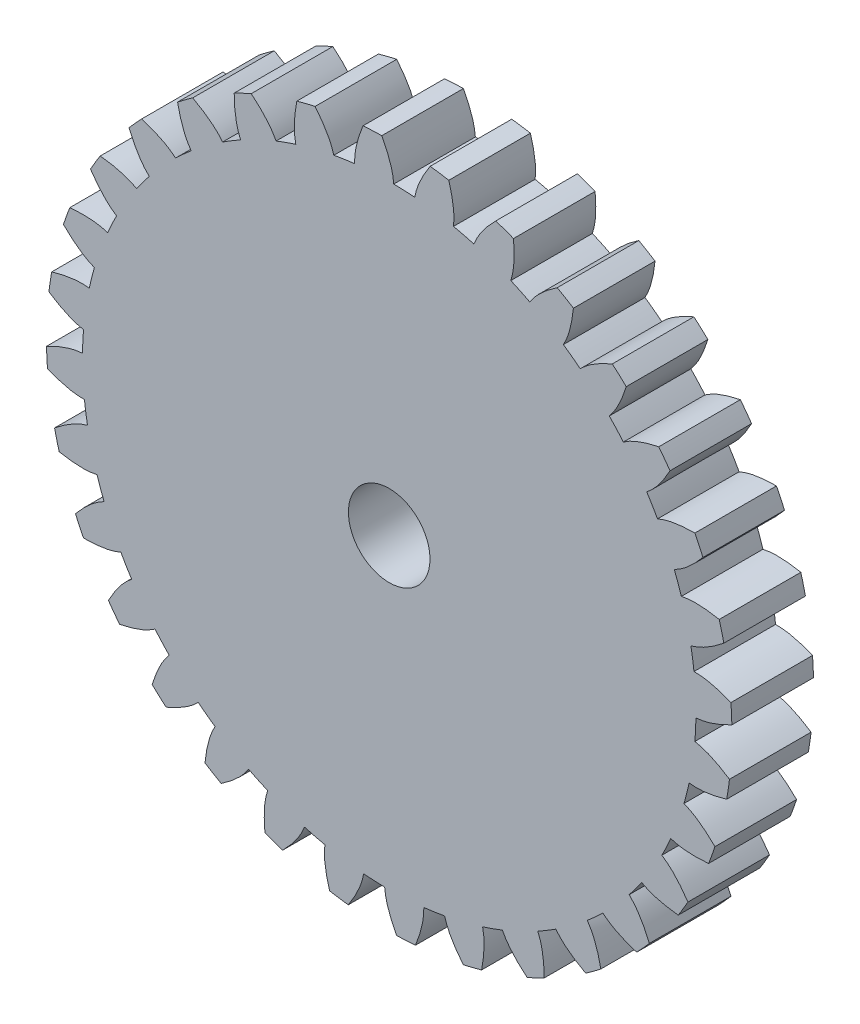
from build123d import *

# Parameters (mm, degrees)
BOSS_EXTRUDE7_DEPTH = 1
CIRPATTERN1_COUNT   = 32
DIAMETRO_BASE_R     = 3.758770483
BOSS_EXTRUDE9_DEPTH = 1
MOZZO_R             = 0.5
CUT_EXTRUDE1_DEPTH  = 1
SKETCH1_R           = 4.25
SKETCH1_R_2         = 4.2
CUT_EXTRUDE2_DEPTH  = 7.090787907


with BuildPart() as part:
    # profilo → Boss-Extrude7 (new body)
    with BuildSketch(Plane.XY):
        with BuildLine():
            Line((-0.208537616, 4.244880689), (-0.184434126, 3.754242879))
            ThreePointArc((-0.184434126, 3.754242879), (-0.064239901, 3.758221492), (0.056020084, 3.758353003))
            add(Edge.make_bspline(
                [(-0.116842984, 4.248393545), (-0.034075941, 4.096076065), (0.042378759, 3.933500457), (0.056020084, 3.758353003)],
                knots=[0.080011926, 0.080011926, 0.080011926, 0.080011926, 1, 1, 1, 1], degree=3))
            ThreePointArc((-0.116842984, 4.248393545), (-0.162699781, 4.246884597), (-0.208537616, 4.244880689))
        make_face()
    extrude(amount=BOSS_EXTRUDE7_DEPTH)

    # Mirror1: part across plane


with BuildPart() as part_1:
    add(part.part)
    add(part.part.mirror(Plane(origin=(0, 0, 0), x_dir=(0, 0, 1), z_dir=(0.9987954562051725, 0.0490676743274181, 0))))


with BuildPart() as cirpattern1_1:
    # CirPattern1: pattern copy
    add(part_1.part.rotate(Axis((0, 0, 0), (0, 0, -1)), 1 * 360 / CIRPATTERN1_COUNT))


with BuildPart() as cirpattern1_2:
    # CirPattern1: pattern copy
    add(part_1.part.rotate(Axis((0, 0, 0), (0, 0, -1)), 2 * 360 / CIRPATTERN1_COUNT))


with BuildPart() as cirpattern1_3:
    # CirPattern1: pattern copy
    add(part_1.part.rotate(Axis((0, 0, 0), (0, 0, -1)), 3 * 360 / CIRPATTERN1_COUNT))


with BuildPart() as cirpattern1_4:
    # CirPattern1: pattern copy
    add(part_1.part.rotate(Axis((0, 0, 0), (0, 0, -1)), 4 * 360 / CIRPATTERN1_COUNT))


with BuildPart() as cirpattern1_5:
    # CirPattern1: pattern copy
    add(part_1.part.rotate(Axis((0, 0, 0), (0, 0, -1)), 5 * 360 / CIRPATTERN1_COUNT))


with BuildPart() as cirpattern1_6:
    # CirPattern1: pattern copy
    add(part_1.part.rotate(Axis((0, 0, 0), (0, 0, -1)), 6 * 360 / CIRPATTERN1_COUNT))


with BuildPart() as cirpattern1_7:
    # CirPattern1: pattern copy
    add(part_1.part.rotate(Axis((0, 0, 0), (0, 0, -1)), 7 * 360 / CIRPATTERN1_COUNT))


with BuildPart() as cirpattern1_8:
    # CirPattern1: pattern copy
    add(part_1.part.rotate(Axis((0, 0, 0), (0, 0, -1)), 8 * 360 / CIRPATTERN1_COUNT))


with BuildPart() as cirpattern1_9:
    # CirPattern1: pattern copy
    add(part_1.part.rotate(Axis((0, 0, 0), (0, 0, -1)), 9 * 360 / CIRPATTERN1_COUNT))


with BuildPart() as cirpattern1_10:
    # CirPattern1: pattern copy
    add(part_1.part.rotate(Axis((0, 0, 0), (0, 0, -1)), 10 * 360 / CIRPATTERN1_COUNT))


with BuildPart() as cirpattern1_11:
    # CirPattern1: pattern copy
    add(part_1.part.rotate(Axis((0, 0, 0), (0, 0, -1)), 11 * 360 / CIRPATTERN1_COUNT))


with BuildPart() as cirpattern1_12:
    # CirPattern1: pattern copy
    add(part_1.part.rotate(Axis((0, 0, 0), (0, 0, -1)), 12 * 360 / CIRPATTERN1_COUNT))


with BuildPart() as cirpattern1_13:
    # CirPattern1: pattern copy
    add(part_1.part.rotate(Axis((0, 0, 0), (0, 0, -1)), 13 * 360 / CIRPATTERN1_COUNT))


with BuildPart() as cirpattern1_14:
    # CirPattern1: pattern copy
    add(part_1.part.rotate(Axis((0, 0, 0), (0, 0, -1)), 14 * 360 / CIRPATTERN1_COUNT))


with BuildPart() as cirpattern1_15:
    # CirPattern1: pattern copy
    add(part_1.part.rotate(Axis((0, 0, 0), (0, 0, -1)), 15 * 360 / CIRPATTERN1_COUNT))


with BuildPart() as cirpattern1_16:
    # CirPattern1: pattern copy
    add(part_1.part.rotate(Axis((0, 0, 0), (0, 0, -1)), 16 * 360 / CIRPATTERN1_COUNT))


with BuildPart() as cirpattern1_17:
    # CirPattern1: pattern copy
    add(part_1.part.rotate(Axis((0, 0, 0), (0, 0, -1)), 17 * 360 / CIRPATTERN1_COUNT))


with BuildPart() as cirpattern1_18:
    # CirPattern1: pattern copy
    add(part_1.part.rotate(Axis((0, 0, 0), (0, 0, -1)), 18 * 360 / CIRPATTERN1_COUNT))


with BuildPart() as cirpattern1_19:
    # CirPattern1: pattern copy
    add(part_1.part.rotate(Axis((0, 0, 0), (0, 0, -1)), 19 * 360 / CIRPATTERN1_COUNT))


with BuildPart() as cirpattern1_20:
    # CirPattern1: pattern copy
    add(part_1.part.rotate(Axis((0, 0, 0), (0, 0, -1)), 20 * 360 / CIRPATTERN1_COUNT))


with BuildPart() as cirpattern1_21:
    # CirPattern1: pattern copy
    add(part_1.part.rotate(Axis((0, 0, 0), (0, 0, -1)), 21 * 360 / CIRPATTERN1_COUNT))


with BuildPart() as cirpattern1_22:
    # CirPattern1: pattern copy
    add(part_1.part.rotate(Axis((0, 0, 0), (0, 0, -1)), 22 * 360 / CIRPATTERN1_COUNT))


with BuildPart() as cirpattern1_23:
    # CirPattern1: pattern copy
    add(part_1.part.rotate(Axis((0, 0, 0), (0, 0, -1)), 23 * 360 / CIRPATTERN1_COUNT))


with BuildPart() as cirpattern1_24:
    # CirPattern1: pattern copy
    add(part_1.part.rotate(Axis((0, 0, 0), (0, 0, -1)), 24 * 360 / CIRPATTERN1_COUNT))


with BuildPart() as cirpattern1_25:
    # CirPattern1: pattern copy
    add(part_1.part.rotate(Axis((0, 0, 0), (0, 0, -1)), 25 * 360 / CIRPATTERN1_COUNT))


with BuildPart() as cirpattern1_26:
    # CirPattern1: pattern copy
    add(part_1.part.rotate(Axis((0, 0, 0), (0, 0, -1)), 26 * 360 / CIRPATTERN1_COUNT))


with BuildPart() as cirpattern1_27:
    # CirPattern1: pattern copy
    add(part_1.part.rotate(Axis((0, 0, 0), (0, 0, -1)), 27 * 360 / CIRPATTERN1_COUNT))


with BuildPart() as cirpattern1_28:
    # CirPattern1: pattern copy
    add(part_1.part.rotate(Axis((0, 0, 0), (0, 0, -1)), 28 * 360 / CIRPATTERN1_COUNT))


with BuildPart() as cirpattern1_29:
    # CirPattern1: pattern copy
    add(part_1.part.rotate(Axis((0, 0, 0), (0, 0, -1)), 29 * 360 / CIRPATTERN1_COUNT))


with BuildPart() as cirpattern1_30:
    # CirPattern1: pattern copy
    add(part_1.part.rotate(Axis((0, 0, 0), (0, 0, -1)), 30 * 360 / CIRPATTERN1_COUNT))


with BuildPart() as cirpattern1_31:
    # CirPattern1: pattern copy
    add(part_1.part.rotate(Axis((0, 0, 0), (0, 0, -1)), 31 * 360 / CIRPATTERN1_COUNT))


with BuildPart() as part_2:
    add(part_1.part)

    add(cirpattern1_1.part)  # Boss-Extrude9 merges CirPattern1_1

    add(cirpattern1_2.part)  # Boss-Extrude9 merges CirPattern1_2

    add(cirpattern1_3.part)  # Boss-Extrude9 merges CirPattern1_3

    add(cirpattern1_4.part)  # Boss-Extrude9 merges CirPattern1_4

    add(cirpattern1_5.part)  # Boss-Extrude9 merges CirPattern1_5

    add(cirpattern1_6.part)  # Boss-Extrude9 merges CirPattern1_6

    add(cirpattern1_7.part)  # Boss-Extrude9 merges CirPattern1_7

    add(cirpattern1_8.part)  # Boss-Extrude9 merges CirPattern1_8

    add(cirpattern1_9.part)  # Boss-Extrude9 merges CirPattern1_9

    add(cirpattern1_10.part)  # Boss-Extrude9 merges CirPattern1_10

    add(cirpattern1_11.part)  # Boss-Extrude9 merges CirPattern1_11

    add(cirpattern1_12.part)  # Boss-Extrude9 merges CirPattern1_12

    add(cirpattern1_13.part)  # Boss-Extrude9 merges CirPattern1_13

    add(cirpattern1_14.part)  # Boss-Extrude9 merges CirPattern1_14

    add(cirpattern1_15.part)  # Boss-Extrude9 merges CirPattern1_15

    add(cirpattern1_16.part)  # Boss-Extrude9 merges CirPattern1_16

    add(cirpattern1_17.part)  # Boss-Extrude9 merges CirPattern1_17

    add(cirpattern1_18.part)  # Boss-Extrude9 merges CirPattern1_18

    add(cirpattern1_19.part)  # Boss-Extrude9 merges CirPattern1_19

    add(cirpattern1_20.part)  # Boss-Extrude9 merges CirPattern1_20

    add(cirpattern1_21.part)  # Boss-Extrude9 merges CirPattern1_21

    add(cirpattern1_22.part)  # Boss-Extrude9 merges CirPattern1_22

    add(cirpattern1_23.part)  # Boss-Extrude9 merges CirPattern1_23

    add(cirpattern1_24.part)  # Boss-Extrude9 merges CirPattern1_24

    add(cirpattern1_25.part)  # Boss-Extrude9 merges CirPattern1_25

    add(cirpattern1_26.part)  # Boss-Extrude9 merges CirPattern1_26

    add(cirpattern1_27.part)  # Boss-Extrude9 merges CirPattern1_27

    add(cirpattern1_28.part)  # Boss-Extrude9 merges CirPattern1_28

    add(cirpattern1_29.part)  # Boss-Extrude9 merges CirPattern1_29

    add(cirpattern1_30.part)  # Boss-Extrude9 merges CirPattern1_30

    add(cirpattern1_31.part)  # Boss-Extrude9 merges CirPattern1_31
    # diametro base → Boss-Extrude9 (add)
    with BuildSketch(Plane.XY):
        Circle(DIAMETRO_BASE_R)
    extrude(amount=BOSS_EXTRUDE9_DEPTH)

    # mozzo → Cut-Extrude1 (cut)
    with BuildSketch(Plane.XY):
        Circle(MOZZO_R)
    extrude(amount=CUT_EXTRUDE1_DEPTH, mode=Mode.SUBTRACT)

    # Sketch1 → Cut-Extrude2 (cut, through all)
    with BuildSketch(Plane.XY.offset(1)):
        Circle(SKETCH1_R)
        Circle(SKETCH1_R_2, mode=Mode.SUBTRACT)
    extrude(amount=-CUT_EXTRUDE2_DEPTH, mode=Mode.SUBTRACT)


solid = part_2.part
